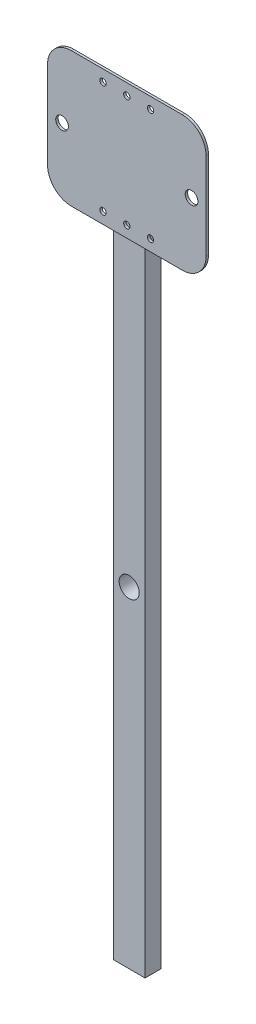
from build123d import *

# Parameters (mm, degrees)
CROQUIS1_R              = 8
CROQUIS1_R_2            = 4
SALIENTE_EXTRUIR1_DEPTH = 3
CROQUIS2_W              = 40
CROQUIS2_H              = 885
CROQUIS2_R              = 12.7
SALIENTE_EXTRUIR2_DEPTH = 20


with BuildPart() as part:
    # Croquis1 → Saliente-Extruir1 (new body)
    with BuildSketch(Plane.XY):
        with BuildLine():
            Line((70, 85), (-70, 85))
            ThreePointArc((-70, 85), (-91.213203436, 76.213203436), (-100, 55))
            Line((-100, 55), (-100, -55))
            ThreePointArc((-100, -55), (-91.213203436, -76.213203436), (-70, -85))
            Line((-70, -85), (70, -85))
            ThreePointArc((70, -85), (91.213203436, -76.213203436), (100, -55))
            Line((100, -55), (100, 55))
            ThreePointArc((100, 55), (91.213203436, 76.213203436), (70, 85))
        make_face()
        with Locations((-81.705, 0)):
            Circle(CROQUIS1_R, mode=Mode.SUBTRACT)
        with Locations((81.705, 0)):
            Circle(CROQUIS1_R, mode=Mode.SUBTRACT)
        with Locations((0, 70.6)):
            Circle(CROQUIS1_R_2, mode=Mode.SUBTRACT)
        with Locations((0, -70.6)):
            Circle(CROQUIS1_R_2, mode=Mode.SUBTRACT)
        with Locations((-30, 70.6)):
            Circle(CROQUIS1_R_2, mode=Mode.SUBTRACT)
        with Locations((30, 70.6)):
            Circle(CROQUIS1_R_2, mode=Mode.SUBTRACT)
        with Locations((-30, -70.6)):
            Circle(CROQUIS1_R_2, mode=Mode.SUBTRACT)
        with Locations((30, -70.6)):
            Circle(CROQUIS1_R_2, mode=Mode.SUBTRACT)
    extrude(amount=SALIENTE_EXTRUIR1_DEPTH)

    # Croquis2 → Saliente-Extruir2 (add)
    with BuildSketch(Plane.XY):
        with Locations((0, -442.5)):
            Rectangle(CROQUIS2_W, CROQUIS2_H)
        with Locations((0, -467.75)):
            Circle(CROQUIS2_R, mode=Mode.SUBTRACT)
    extrude(amount=-SALIENTE_EXTRUIR2_DEPTH)


solid = part.part
